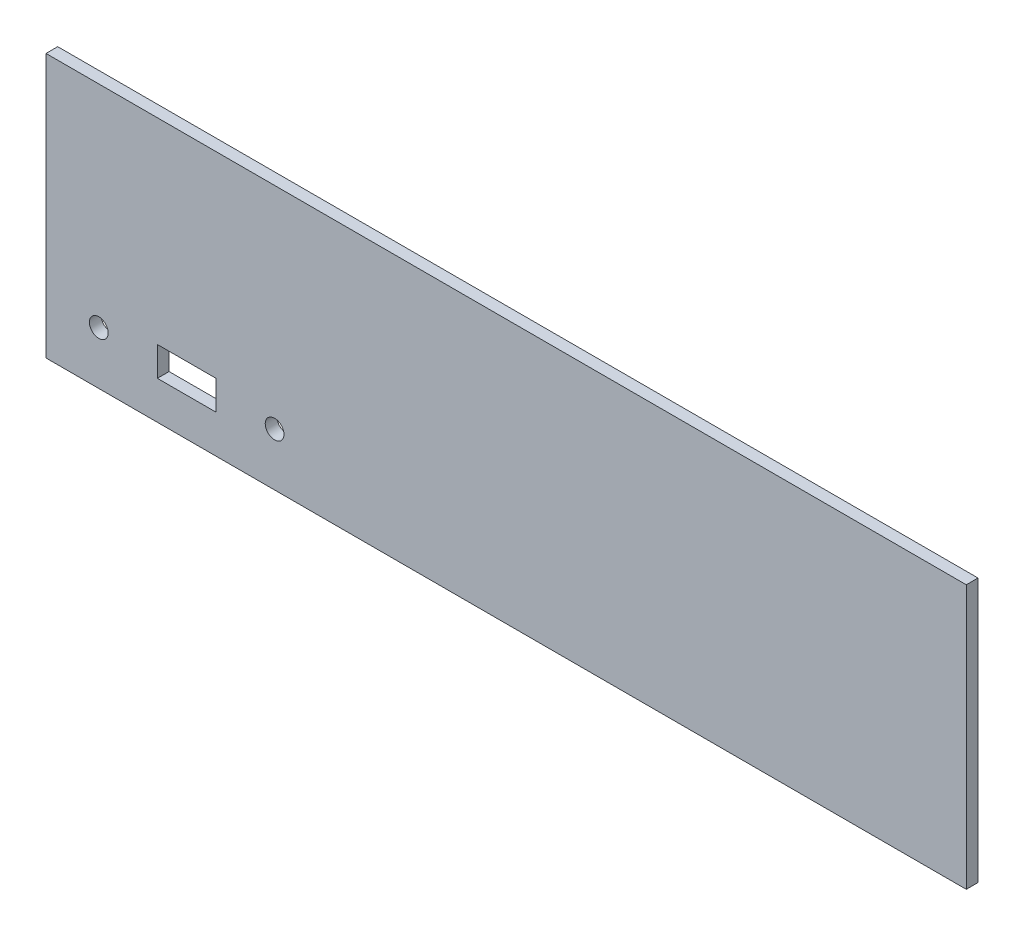
from build123d import *

# Parameters (mm, degrees)
SKETCH1_W           = 157
SKETCH1_H           = 45
BOSS_EXTRUDE1_DEPTH = 2
SKETCH2_R           = 1.6
SKETCH2_W           = 10
SKETCH2_H           = 5
CUT_EXTRUDE1_DEPTH  = 82.685372007


with BuildPart() as part:
    # Sketch1 → Boss-Extrude1 (new body)
    with BuildSketch(Plane.XY):
        Rectangle(SKETCH1_W, SKETCH1_H)
    extrude(amount=BOSS_EXTRUDE1_DEPTH)

    # Sketch2 → Cut-Extrude1 (cut, through all)
    with BuildSketch(Plane.XY.offset(2)):
        with Locations((-69.5, -13.5)):
            Circle(SKETCH2_R)
        with Locations(Location((-39.5, -13.5, 0), (0, 0, 180))):
            Circle(SKETCH2_R)
        with Locations((-54.5, -13.5)):
            Rectangle(SKETCH2_W, SKETCH2_H)
    extrude(amount=-CUT_EXTRUDE1_DEPTH, mode=Mode.SUBTRACT)


solid = part.part
